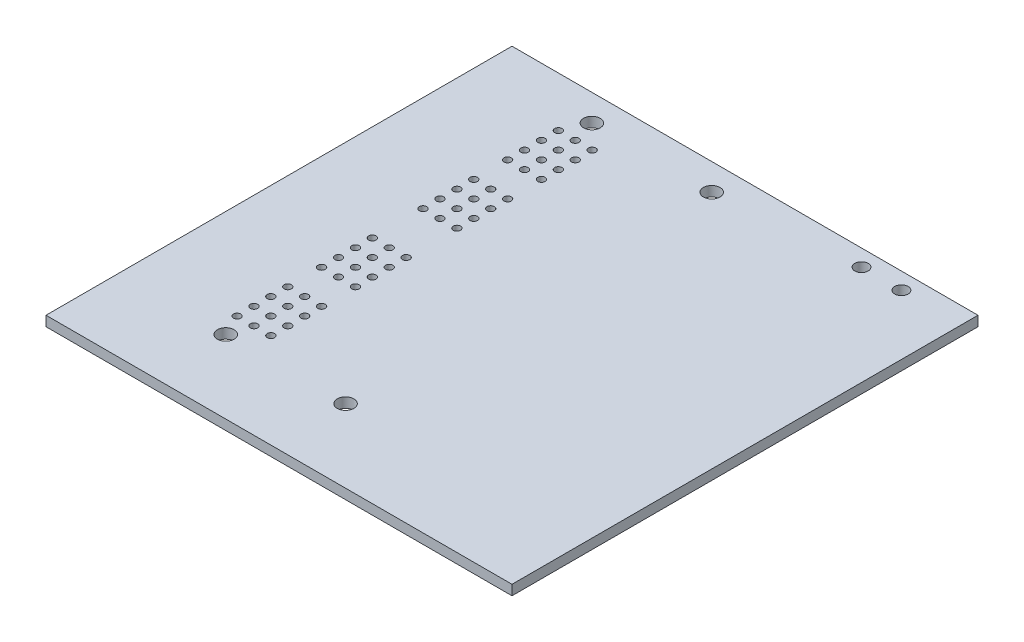
from build123d import *

# Parameters (mm, degrees)
ESBO_O1_W                = 70
ESBO_O1_H                = 70
ESBO_O1_R                = 1.25
ESBO_O1_R_2              = 1
RESSALTO_EXTRUS_O1_DEPTH = 1.5
ESBO_O2_R                = 0.55
CORTE_EXTRUS_O1_DEPTH    = 50.520197899
PADR_O_LINEAR1_COUNT     = 20
PADR_O_LINEAR1_PITCH     = 2.54


with BuildPart() as part:
    # Esboço1 → Ressalto-extrusão1 (new body)
    with BuildSketch(Plane(origin=(0, 0, 0), x_dir=(1, 0, 0), z_dir=(0, 1, 0))):
        Rectangle(ESBO_O1_W, ESBO_O1_H)
        with Locations(Location((-19, 31, 0), (0, 0, 270))):
            Circle(ESBO_O1_R, mode=Mode.SUBTRACT)
        with Locations(Location((-1, 31, 0), (0, 0, 270))):
            Circle(ESBO_O1_R, mode=Mode.SUBTRACT)
        with Locations(Location((-1, -24, 0), (0, 0, 270))):
            Circle(ESBO_O1_R, mode=Mode.SUBTRACT)
        with Locations(Location((-19, -24, 0), (0, 0, 270))):
            Circle(ESBO_O1_R, mode=Mode.SUBTRACT)
        with Locations(Location((20, 32.5, 0), (0, 0, 270))):
            Circle(ESBO_O1_R_2, mode=Mode.SUBTRACT)
        with Locations(Location((26, 32.5, 0), (0, 0, 270))):
            Circle(ESBO_O1_R_2, mode=Mode.SUBTRACT)
    extrude(amount=RESSALTO_EXTRUS_O1_DEPTH)

    # Esboço2 → Corte-extrusão1 (cut, through all)
    with BuildSketch(Plane(origin=(0, 1.5, 0), x_dir=(1, 0, 0), z_dir=(0, 1, 0))):
        with Locations(Location((-20.54, 27.5, 0), (0, 0, 270))):
            Circle(ESBO_O2_R)
        with Locations(Location((-18, 27.5, 0), (0, 0, 270))):
            Circle(ESBO_O2_R)
        with Locations(Location((-15.46, 27.5, 0), (0, 0, 270))):
            Circle(ESBO_O2_R)
    corte_extrus_o1 = extrude(amount=-CORTE_EXTRUS_O1_DEPTH, mode=Mode.SUBTRACT)

    # Padrão linear1: Corte-extrusão1 ×20, 4 skipped
    with Locations(*[(0, 0, i * PADR_O_LINEAR1_PITCH) for i in range(1, PADR_O_LINEAR1_COUNT) if i not in (4, 9, 10, 15)]):
        add(corte_extrus_o1, mode=Mode.SUBTRACT)


solid = part.part
